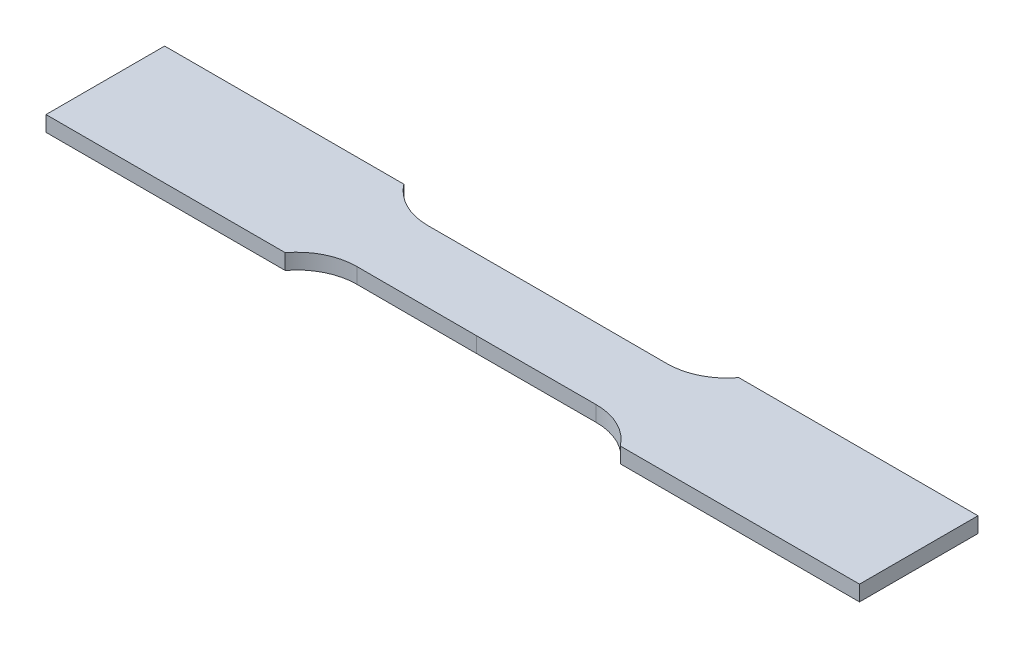
from build123d import *

# Parameters (mm, degrees)
BOSS_EXTRUDE2_DEPTH = 3.227


with BuildPart() as part:
    # Sketch1 → Boss-Extrude2 (new body)
    with BuildSketch(Plane(origin=(0, 0, 0), x_dir=(1, 0, 0), z_dir=(0, 1, 0))):
        with BuildLine():
            Line((35, 12.381710977), (85, 12.381710977))
            Line((85, 12.381710977), (85, -12.381710977))
            Line((85, -12.381710977), (35, -12.381710977))
            ThreePointArc((35, -12.381710977), (30.586810484, -8.714242442), (25, -7.405))
            Line((25, -7.405), (0, -7.44))
            Line((0, -7.44), (-25, -7.415008884))
            ThreePointArc((-25, -7.415008884), (-30.587769043, -8.727226921), (-35, -12.398370753))
            Line((-35, -12.398370753), (-85, -12.398370753))
            Line((-85, -12.398370753), (-85, 12.398370753))
            Line((-85, 12.398370753), (-35, 12.398370753))
            ThreePointArc((-35, 12.398370753), (-30.587769043, 8.727226921), (-25, 7.415008884))
            Line((-25, 7.415008884), (0, 7.44))
            Line((0, 7.44), (25, 7.405))
            ThreePointArc((25, 7.405), (30.586810484, 8.714242442), (35, 12.381710977))
        make_face()
    extrude(amount=BOSS_EXTRUDE2_DEPTH)


solid = part.part
